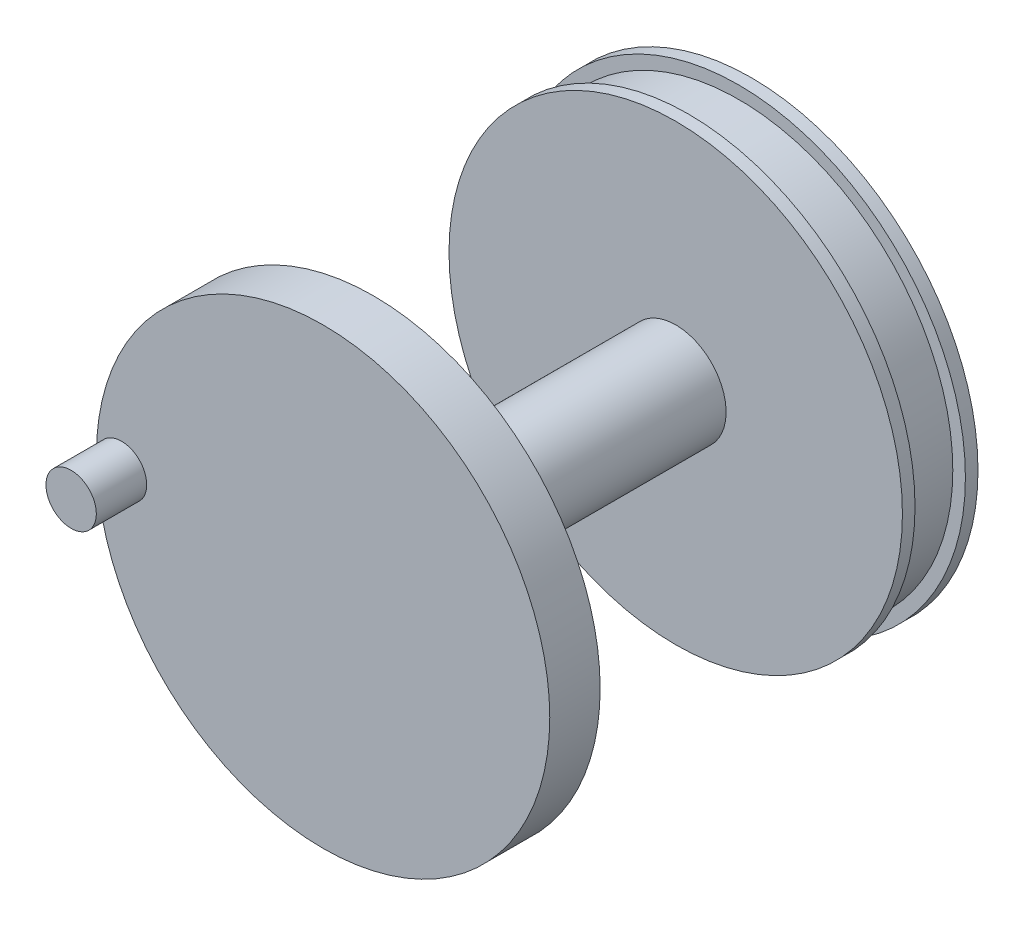
from build123d import *

# Parameters (mm, degrees)
SKETCH1_R           = 45
BOSS_EXTRUDE1_DEPTH = 10
SKETCH2_R           = 5
BOSS_EXTRUDE2_DEPTH = 10
SKETCH3_R           = 10
BOSS_EXTRUDE3_DEPTH = 60
BOSS_EXTRUDE4_START = 15
SKETCH4_R           = 45
BOSS_EXTRUDE4_DEPTH = 15
CUT_EXTRUDE1_START  = -2.5
SKETCH5_R           = 45
SKETCH5_R_2         = 42.5
CUT_EXTRUDE1_DEPTH  = 10


with BuildPart() as part:
    # Sketch1 → Boss-Extrude1 (new body)
    with BuildSketch(Plane.XY):
        Circle(SKETCH1_R)
    extrude(amount=BOSS_EXTRUDE1_DEPTH)

    # Sketch2 → Boss-Extrude2 (add)
    with BuildSketch(Plane.XY.offset(20)):
        with Locations((-40, 0)):
            Circle(SKETCH2_R)
    extrude(amount=-BOSS_EXTRUDE2_DEPTH)

    # Sketch3 → Boss-Extrude3 (add)
    with BuildSketch(Plane(origin=(0, 0, 0), x_dir=(-1, 0, 0), z_dir=(0, 0, -1))):
        Circle(SKETCH3_R)
    extrude(amount=BOSS_EXTRUDE3_DEPTH)

    # Sketch4 → Boss-Extrude4 (add)
    with BuildSketch(Plane(origin=(0, 0, -60), x_dir=(-1, 0, 0), z_dir=(0, 0, -1)).offset(BOSS_EXTRUDE4_START)):
        Circle(SKETCH4_R)
    extrude(amount=-BOSS_EXTRUDE4_DEPTH)

    # Sketch5 → Cut-Extrude1 (cut)
    with BuildSketch(Plane(origin=(0, 0, -75), x_dir=(-1, 0, 0), z_dir=(0, 0, -1)).offset(CUT_EXTRUDE1_START)):
        Circle(SKETCH5_R)
        Circle(SKETCH5_R_2, mode=Mode.SUBTRACT)
    extrude(amount=-CUT_EXTRUDE1_DEPTH, mode=Mode.SUBTRACT)


solid = part.part
